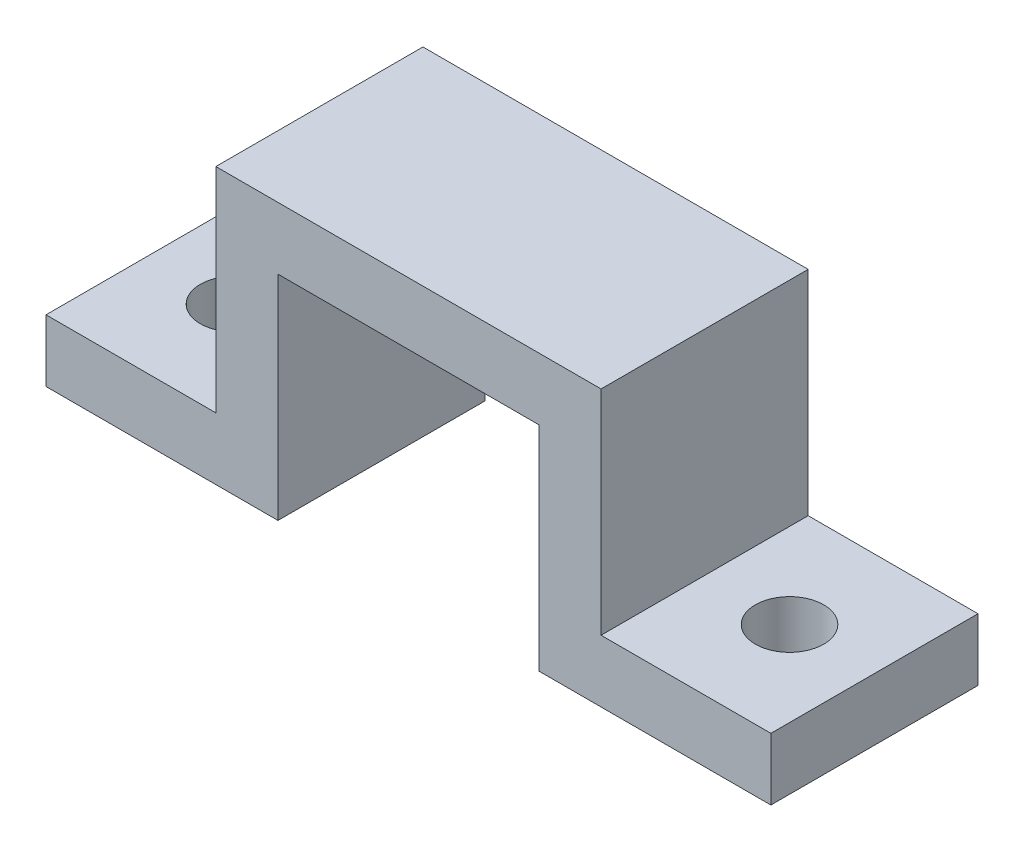
from build123d import *

# Parameters (mm, degrees)
BOSS_EXTRUDE1_DEPTH = 10
SKETCH2_R           = 1.65
CUT_EXTRUDE1_DEPTH  = 3


with BuildPart() as part:
    # Sketch1 → Boss-Extrude1 (new body)
    with BuildSketch(Plane.XY):
        Polygon((17.5, -5.15), (6.3, -5.15), (6.3, 5.15), (-6.3, 5.15), (-6.3, -5.15), (-17.5, -5.15), (-17.5, -2.15), (-9.3, -2.15), (-9.3, 8.15), (9.3, 8.15), (9.3, -2.15), (17.5, -2.15), align=None)
    extrude(amount=BOSS_EXTRUDE1_DEPTH)

    # Sketch2 → Cut-Extrude1 (cut)
    with BuildSketch(Plane(origin=(0, -2.15, 0), x_dir=(1, 0, 0), z_dir=(0, 1, 0))):
        with Locations(Location((13.4, -5, 0), (0, 0, 270))):
            Circle(SKETCH2_R)
        with Locations(Location((-13.4, -5, 0), (0, 0, 270))):
            Circle(SKETCH2_R)
    extrude(amount=-CUT_EXTRUDE1_DEPTH, mode=Mode.SUBTRACT)


solid = part.part
